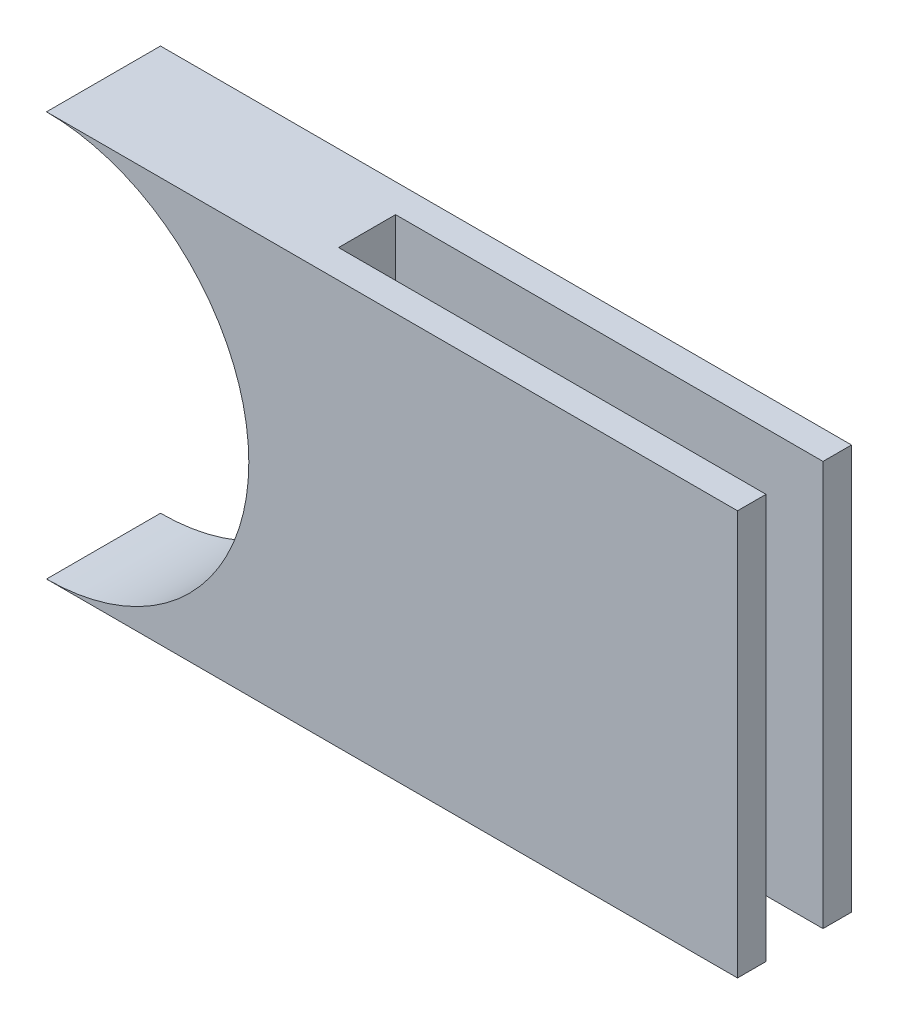
from build123d import *

# Parameters (mm, degrees)
SKETCH1_R               = 19.939
CIRCLE_EXTRUDE_DEPTH    = 7.62
SKETCH3_W               = 7.62
SKETCH3_H               = 39.878
RECTANGLE_EXTRUDE_DEPTH = 63.5
SKETCH2_R               = 18.034
CRICLE_CUT_DEPTH        = 67.991627245
SKETCH4_OUTSIDE_W       = 103.997
SKETCH4_OUTSIDE_H       = 60.436
SKETCH4_OUTSIDE_W_2     = 61.595
SKETCH4_OUTSIDE_H_2     = 36.068
FRAME_CUT_DEPTH         = 67.991627245
EXTENSION_DEPTH         = 2.54
SKETCH13_W              = 5.08
SKETCH13_H              = 36.068
CUT_EXTRUDE1_DEPTH      = 38.1
SKETCH14_R              = 1.905
BOSS_EXTRUDE3_DEPTH     = 2.54


with BuildPart() as part:
    # Sketch1 → circle extrude (new body)
    with BuildSketch(Plane.XY):
        with Locations(Location((0, 0, 0), (0, 0, 180))):
            Circle(SKETCH1_R)
    extrude(amount=CIRCLE_EXTRUDE_DEPTH)

    # Sketch3 → rectangle extrude (add)
    with BuildSketch(Plane(origin=(0, 0, 0), x_dir=(0, 0, -1), z_dir=(1, 0, 0))):
        with Locations((-3.81, 0)):
            Rectangle(SKETCH3_W, SKETCH3_H)
    extrude(amount=RECTANGLE_EXTRUDE_DEPTH)

    # Sketch2 → cricle cut (cut, through all)
    with BuildSketch(Plane.XY.offset(7.62)):
        Circle(SKETCH2_R)
    extrude(amount=-CRICLE_CUT_DEPTH, mode=Mode.SUBTRACT)

    # Sketch4 outside → frame cut (cut, through all)
    with BuildSketch(Plane.XY.offset(7.62)):
        with Locations((21.7805, 0)):
            Rectangle(SKETCH4_OUTSIDE_W, SKETCH4_OUTSIDE_H)
        with Locations((30.7975, 0)):
            Rectangle(SKETCH4_OUTSIDE_W_2, SKETCH4_OUTSIDE_H_2, mode=Mode.SUBTRACT)
    extrude(amount=-FRAME_CUT_DEPTH, mode=Mode.SUBTRACT)

    # Sketch10 → extension (add)
    with BuildSketch(Plane(origin=(0, 0, 0), x_dir=(-1, 0, 0), z_dir=(0, 0, -1))):
        with BuildLine():
            Line((0, 18.034), (-61.595, 18.034))
            Line((-61.595, 18.034), (-61.595, -18.034))
            Line((-61.595, -18.034), (0, -18.034))
            ThreePointArc((0, -18.034), (-18.034, 0), (0, 18.034))
        make_face()
    extrude(amount=EXTENSION_DEPTH)

    # Sketch13 → Cut-Extrude1 (cut)
    with BuildSketch(Plane(origin=(61.595, 0, 0), x_dir=(0, 0, -1), z_dir=(1, 0, 0))):
        with Locations((-2.54, 0)):
            Rectangle(SKETCH13_W, SKETCH13_H)
    extrude(amount=-CUT_EXTRUDE1_DEPTH, mode=Mode.SUBTRACT)

    # Sketch14 → Boss-Extrude3 (add)
    with BuildSketch(Plane(origin=(23.495, 0, 0), x_dir=(0, 0, -1), z_dir=(1, 0, 0))):
        with Locations((-2.54, 0)):
            Circle(SKETCH14_R)
    extrude(amount=BOSS_EXTRUDE3_DEPTH)


solid = part.part
